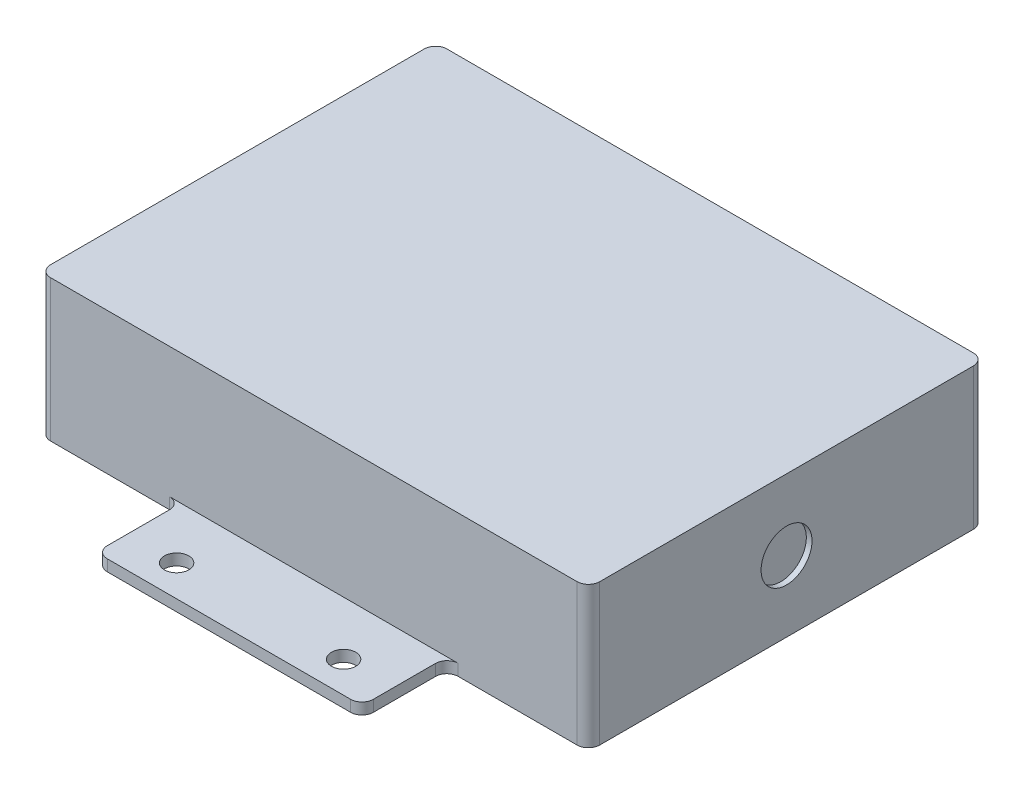
from build123d import *

# Parameters (mm, degrees)
SKETCH1_W            = 97
SKETCH1_H            = 100
BOSS_EXTRUDE1_DEPTH  = 25
M4_CLEARANCE_HOLE1_D = 4.3
SKETCH5_W            = 32
SKETCH5_H            = 13
CUT_EXTRUDE1_DEPTH   = 1
SKETCH6_R            = 4.5
CUT_EXTRUDE2_DEPTH   = 1
SKETCH7_W            = 97
SKETCH7_H            = 15
CUT_EXTRUDE3_DEPTH   = 23
SKETCH8_W            = 25
SKETCH8_H            = 15
CUT_EXTRUDE4_DEPTH   = 74.357003756
FILLET1_R            = 2


with BuildPart() as part:
    # Sketch1 → Boss-Extrude1 (new body)
    with BuildSketch(Plane(origin=(0, 0, 0), x_dir=(1, 0, 0), z_dir=(0, 1, 0))):
        Rectangle(SKETCH1_W, SKETCH1_H)
    extrude(amount=BOSS_EXTRUDE1_DEPTH)

    # M4 Clearance Hole1 (through all)
    with Locations(Plane(origin=(0, 25, 0), x_dir=(1, 0, 0), z_dir=(0, 1, 0))):
        with Locations((-14.75, 44.5), (14.75, 44.5), (-14.75, -44.5), (14.75, -44.5)):
            Hole(M4_CLEARANCE_HOLE1_D / 2)

    # Sketch5 → Cut-Extrude1 (cut)
    with BuildSketch(Plane.ZY.offset(48.5)):
        with Locations((0, 13.5)):
            Rectangle(SKETCH5_W, SKETCH5_H)
    extrude(amount=-CUT_EXTRUDE1_DEPTH, mode=Mode.SUBTRACT)

    # Sketch6 → Cut-Extrude2 (cut)
    with BuildSketch(Plane(origin=(48.5, 0, 0), x_dir=(0, 0, -1), z_dir=(1, 0, 0))):
        with Locations((0, 12.5)):
            Circle(SKETCH6_R)
    extrude(amount=-CUT_EXTRUDE2_DEPTH, mode=Mode.SUBTRACT)

    # Sketch7 → Cut-Extrude3 (cut)
    with BuildSketch(Plane(origin=(0, 25, 0), x_dir=(1, 0, 0), z_dir=(0, 1, 0))):
        with Locations((0, 42.5)):
            Rectangle(SKETCH7_W, SKETCH7_H)
        with Locations((0, -42.5)):
            Rectangle(SKETCH7_W, SKETCH7_H)
    extrude(amount=-CUT_EXTRUDE3_DEPTH, mode=Mode.SUBTRACT)

    # Sketch8 → Cut-Extrude4 (cut, through all)
    with BuildSketch(Plane(origin=(0, 2, 0), x_dir=(1, 0, 0), z_dir=(0, 1, 0))):
        with Locations((-36, 42.5)):
            Rectangle(SKETCH8_W, SKETCH8_H)
        with Locations((36, 42.5)):
            Rectangle(SKETCH8_W, SKETCH8_H)
        with Locations((-36, -42.5)):
            Rectangle(SKETCH8_W, SKETCH8_H)
        with Locations((36, -42.5)):
            Rectangle(SKETCH8_W, SKETCH8_H)
    extrude(amount=-CUT_EXTRUDE4_DEPTH, mode=Mode.SUBTRACT)

    # Fillet1
    fillet1_edges = [part.edges().sort_by_distance(p)[0] for p in [
        (23.5, 1, -35),
        (23.5, 1, -50),
        (-23.5, 1, 35),
        (-23.5, 1, 50),
        (23.5, 1, 50),
        (23.5, 1, 35),
        (-23.5, 1, -50),
        (-23.5, 1, -35),
        (48.5, 12.5, -35),
        (-48.5, 12.5, -35),
        (48.5, 12.5, 35),
        (-48.5, 12.5, 35),
    ]]
    fillet(fillet1_edges, radius=FILLET1_R)


solid = part.part
